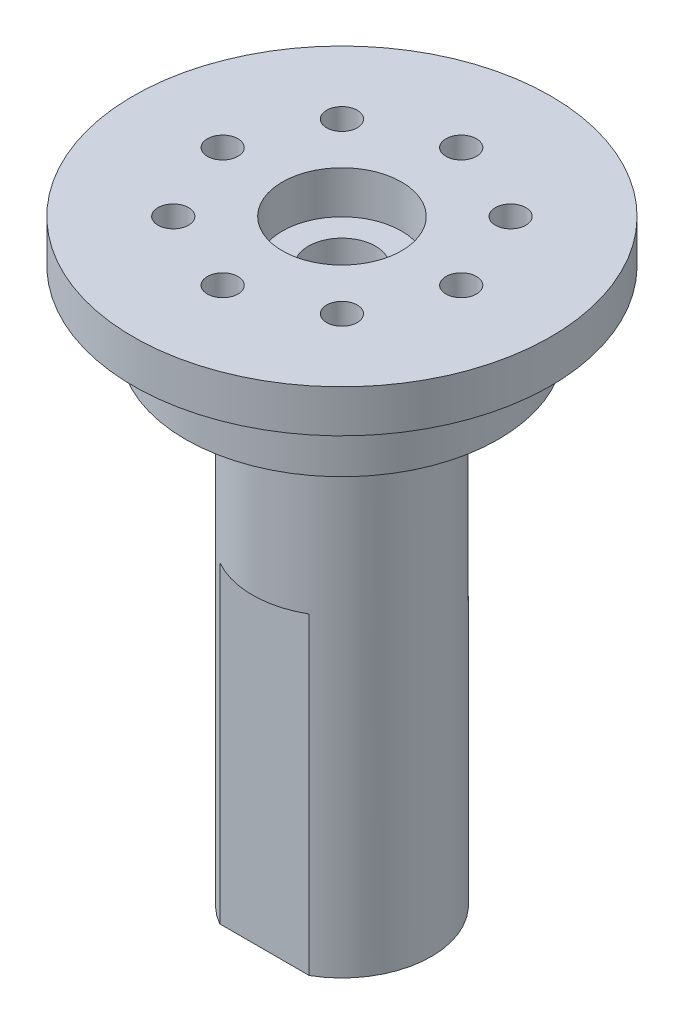
from build123d import *

# Parameters (mm, degrees)
TAP_DRILL_FOR_M2_5X0_45_TAP2_D = 2.05
CUT_EXTRUDE1_DEPTH             = 21


with BuildPart() as part:
    # Sketch3 → Revolve1 (revolve)
    with BuildSketch(Plane.XY, mode=Mode.PRIVATE) as revolve1_sk:
        Polygon((-2.25, 34.3), (0, 34.3), (0, 0), (-6, 0), (-6, 32.3), (-10.5, 32.3), (-10.5, 37.15), (-14, 37.15), (-14, 40), (-4, 40), (-4, 37.15), (-2.25, 37.15), align=None)
    revolve(revolve1_sk.sketch.rotate(Axis((0, 0, 0), (0, 1, 0)), 270), axis=Axis((0, 0, 0), (0, 1, 0)))

    # Tap Drill for M2.5x0.45 Tap2 (through all)
    with Locations(Plane.XZ.offset(-32.3)):
        with Locations((-5.656854249, 5.656854249), (0, 8), (5.656854249, 5.656854249), (8, 0), (5.656854249, -5.656854249), (0, -8), (-5.656854249, -5.656854249), (-8, 0)):
            Hole(TAP_DRILL_FOR_M2_5X0_45_TAP2_D / 2)

    # Sketch13 → Cut-Extrude1 (cut)
    with BuildSketch(Plane.XZ):
        Polygon((-64.283224073, 5.196152423), (-3, 5.196152423), (3, 5.196152423), (64.283224073, 5.196152423), (64.283224073, 127.762600569), (-64.283224073, 127.762600569), align=None)
    extrude(amount=-CUT_EXTRUDE1_DEPTH, mode=Mode.SUBTRACT)


solid = part.part
